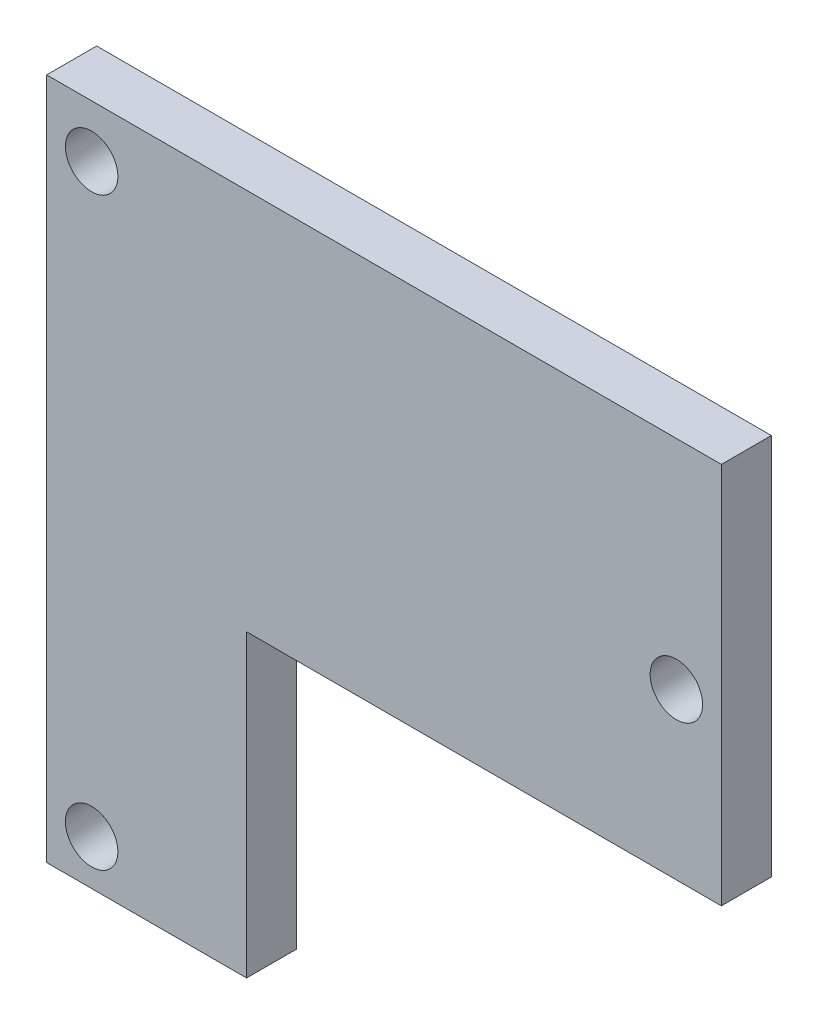
from build123d import *

# Parameters (mm, degrees)
SKETCH1_R           = 1.05
BOSS_EXTRUDE1_DEPTH = 2


with BuildPart() as part:
    # Sketch1 → Boss-Extrude1 (new body)
    with BuildSketch(Plane.XY):
        Polygon((-53.65, -57.3), (-45.65, -57.3), (-45.65, -45.3), (-26.65, -45.3), (-26.65, -30), (-53.65, -30), align=None)
        with Locations((-28.45, -38.7)):
            Circle(SKETCH1_R, mode=Mode.SUBTRACT)
        with Locations((-51.85, -32.1)):
            Circle(SKETCH1_R, mode=Mode.SUBTRACT)
        with Locations((-51.85, -55.5)):
            Circle(SKETCH1_R, mode=Mode.SUBTRACT)
    extrude(amount=BOSS_EXTRUDE1_DEPTH)


solid = part.part
